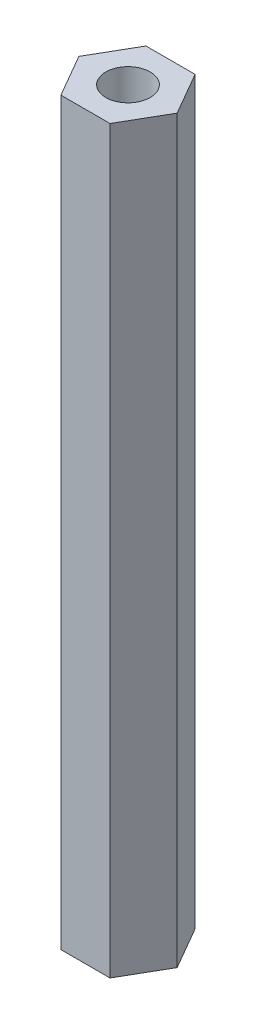
from build123d import *

# Parameters (mm, degrees)
SKETCH1_R           = 1.2
BOSS_EXTRUDE1_DEPTH = 40


with BuildPart() as part:
    # Sketch1 → Boss-Extrude1 (new body)
    with BuildSketch(Plane(origin=(0, 0, 0), x_dir=(1, 0, 0), z_dir=(0, 1, 0))):
        Polygon((2.655811238, 0), (1.327905619, 2.3), (-1.327905619, 2.3), (-2.655811238, 0), (-1.327905619, -2.3), (1.327905619, -2.3), align=None)
        with Locations(Location((0, 0, 0), (0, 0, 270))):
            Circle(SKETCH1_R, mode=Mode.SUBTRACT)
    extrude(amount=BOSS_EXTRUDE1_DEPTH)


solid = part.part
